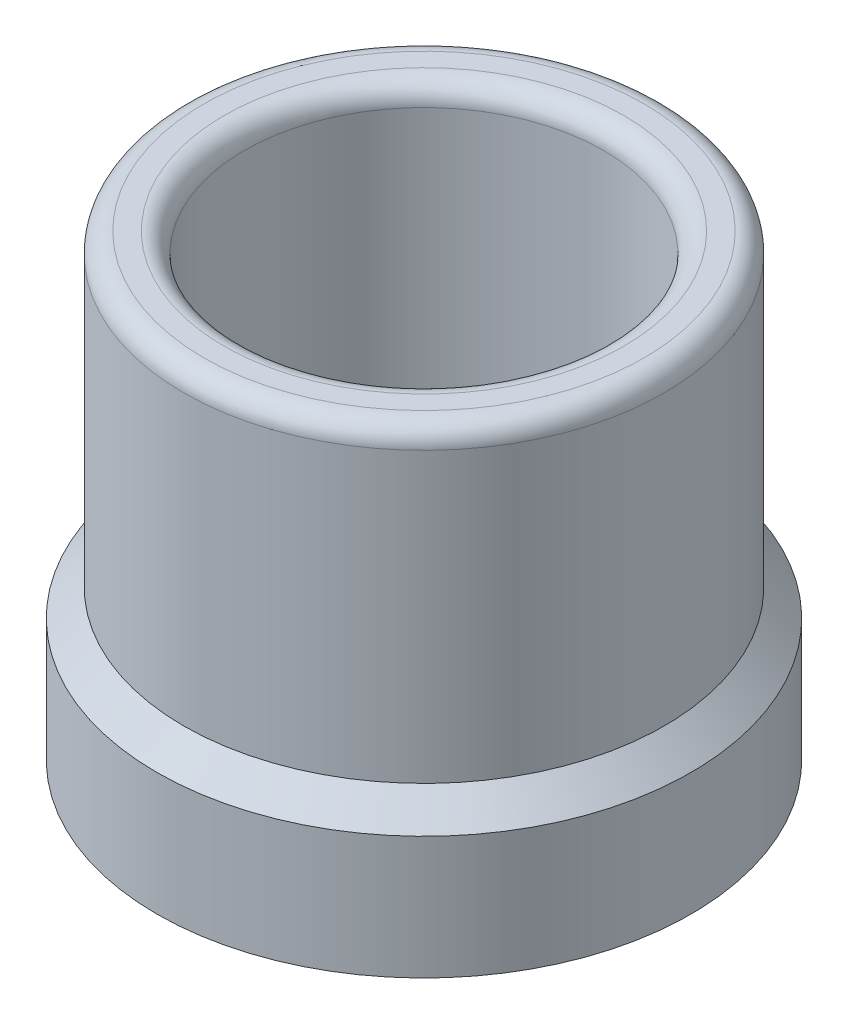
from build123d import *

# Parameters (mm, degrees)
FILLET1_R = 0.5


with BuildPart() as part:
    # Sketch2 → Revolve1 (revolve)
    with BuildSketch(Plane.XY.offset(-3.5)):
        with BuildLine():
            ThreePointArc((-21.891294302, 94.7), (-21.391294302, 95.2), (-20.891294302, 94.7))
            Line((-20.891294302, 94.7), (-20.891294302, 92.5))
            ThreePointArc((-20.891294302, 92.5), (-20.141294302, 92.25), (-19.391294302, 92.5))
            Line((-19.391294302, 92.5), (-19.391294302, 95.536294302))
            Line((-19.391294302, 95.536294302), (-20.055, 96.2))
            Line((-20.055, 96.2), (-20.055, 103.8368))
            Line((-20.055, 103.8368), (-21.555, 103.8368))
            Line((-21.555, 103.8368), (-21.555, 96.7375))
            Line((-21.555, 96.7375), (-22.675639033, 96.7375))
            Line((-22.675639033, 96.7375), (-22.675639033, 94.7))
            Line((-22.675639033, 94.7), (-21.891294302, 94.7))
        make_face()
    revolve(axis=Axis((-26, 90.5, -3.5), (0, 1, 0)))

    # Fillet1
    fillet1_edges = [part.edges().sort_by_distance(p)[0] for p in [
        (-30.445, 103.8368, -3.5),
        (-31.945, 103.8368, -3.5),
    ]]
    fillet(fillet1_edges, radius=FILLET1_R)


solid = part.part
